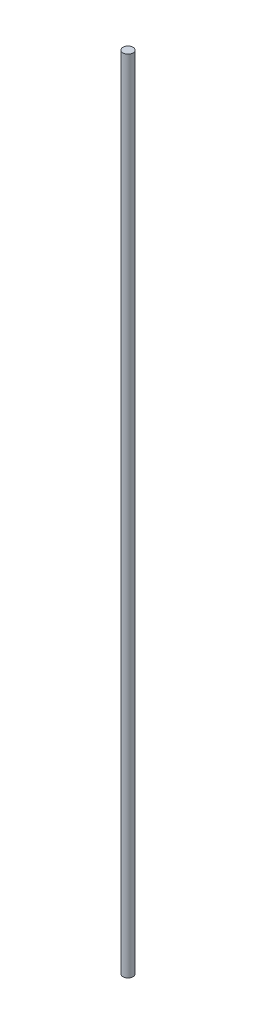
from build123d import *

# Parameters (mm, degrees)
SKETCH1_R           = 1.27
BOSS_EXTRUDE1_DEPTH = 203.2


with BuildPart() as part:
    # Sketch1 → Boss-Extrude1 (new body)
    with BuildSketch(Plane(origin=(0, 0, 0), x_dir=(1, 0, 0), z_dir=(0, 1, 0))):
        with Locations(Location((0, 0, 0), (0, 0, 270))):
            Circle(SKETCH1_R)
    extrude(amount=BOSS_EXTRUDE1_DEPTH)


solid = part.part
